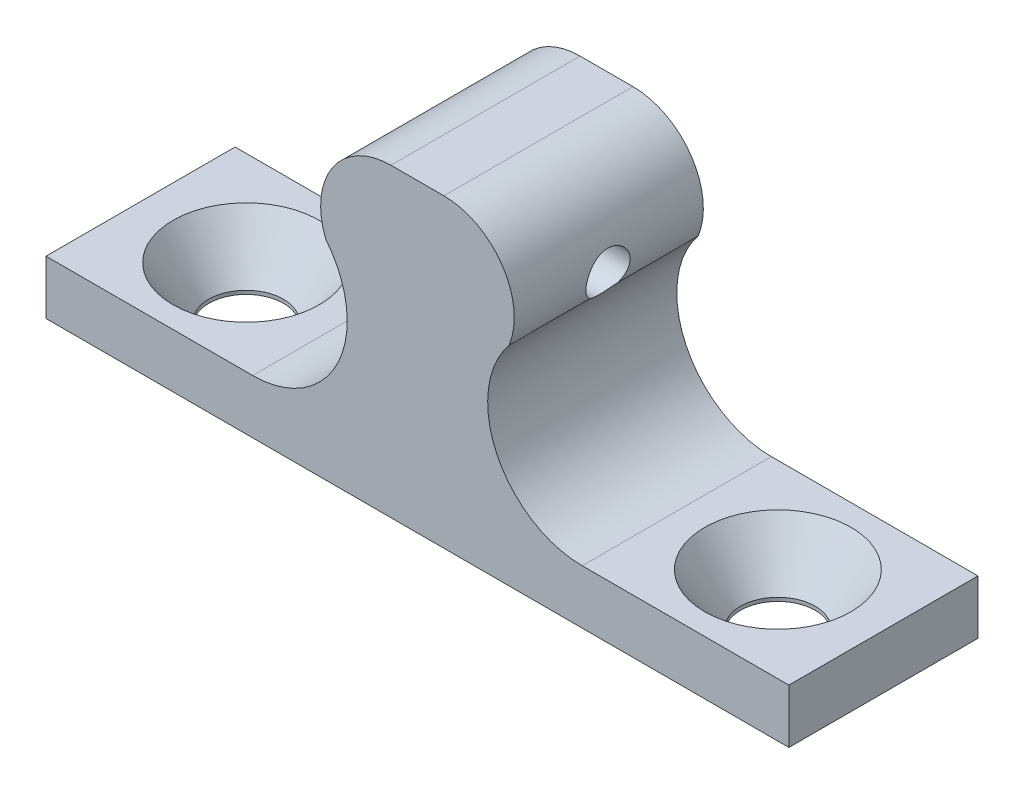
from build123d import *

# Parameters (mm, degrees)
BOSS_EXTRUDE1_DEPTH                       = 10.668
CSK_FOR_6_FLAT_HEAD_MACHINE_SCREW_2_COUNT = 2
CSK_FOR_6_FLAT_HEAD_MACHINE_SCREW_2_PITCH = 29.9974
SKETCH4_R                                 = 1.238307914
CUT_EXTRUDE1_DEPTH                        = 2540


with BuildPart() as part:
    # Sketch1 → Boss-Extrude1 (new body)
    with BuildSketch(Plane.XY.offset(21.5138)):
        with BuildLine():
            Line((9.7663, 28.448), (-1.8923, 28.448))
            Line((-1.8923, 28.448), (-1.8923, 25.4))
            Line((-1.8923, 25.4), (40.0177, 25.4))
            Line((40.0177, 25.4), (40.0177, 28.448))
            Line((40.0177, 28.448), (28.3591, 28.448))
            ThreePointArc((28.3591, 28.448), (23.537953793, 31.499872647), (24.233689565, 37.163204629))
            ThreePointArc((24.233689565, 37.163204629), (23.84595434, 40.870617487), (20.55495, 42.6212))
            Line((20.55495, 42.6212), (17.57045, 42.6212))
            ThreePointArc((17.57045, 42.6212), (14.27944566, 40.870617487), (13.891710435, 37.163204629))
            ThreePointArc((13.891710435, 37.163204629), (14.587446207, 31.499872647), (9.7663, 28.448))
        make_face()
    extrude(amount=-BOSS_EXTRUDE1_DEPTH)

    # Sketch2 → CSK for #6 Flat Head Machine Screw (100)1 (revolve, cut)
    with BuildSketch(Plane(origin=(34.0614, 28.448, 16.1798), x_dir=(0, 0, 1), z_dir=(1, 0, 0))):
        Polygon((0, 0), (0, 3.048), (2.1082, 3.048), (2.1082, 2.844805148), (4.1275, 0), align=None)
    csk_for_6_flat_head_machine_screw_100 = revolve(axis=Axis((34.0614, 34.798, 16.1798), (0, -1, 0)), mode=Mode.SUBTRACT)

    # CSK for _6 Flat Head Machine Screw _ 2: CSK for #6 Flat Head Machine Screw (100)1 ×2
    with Locations(*[(-i * CSK_FOR_6_FLAT_HEAD_MACHINE_SCREW_2_PITCH, 0, 0) for i in range(1, CSK_FOR_6_FLAT_HEAD_MACHINE_SCREW_2_COUNT)]):
        add(csk_for_6_flat_head_machine_screw_100, mode=Mode.SUBTRACT)

    # Sketch4 → Cut-Extrude1 (cut)
    with BuildSketch(Plane(origin=(0, 0, 0), x_dir=(0, 0, -1), z_dir=(1, 0, 0))):
        with Locations(Location((-16.1798, 38.109028288, 0), (0, 0, 229.800644601))):
            Circle(SKETCH4_R)
    extrude(amount=CUT_EXTRUDE1_DEPTH, mode=Mode.SUBTRACT)


solid = part.part
